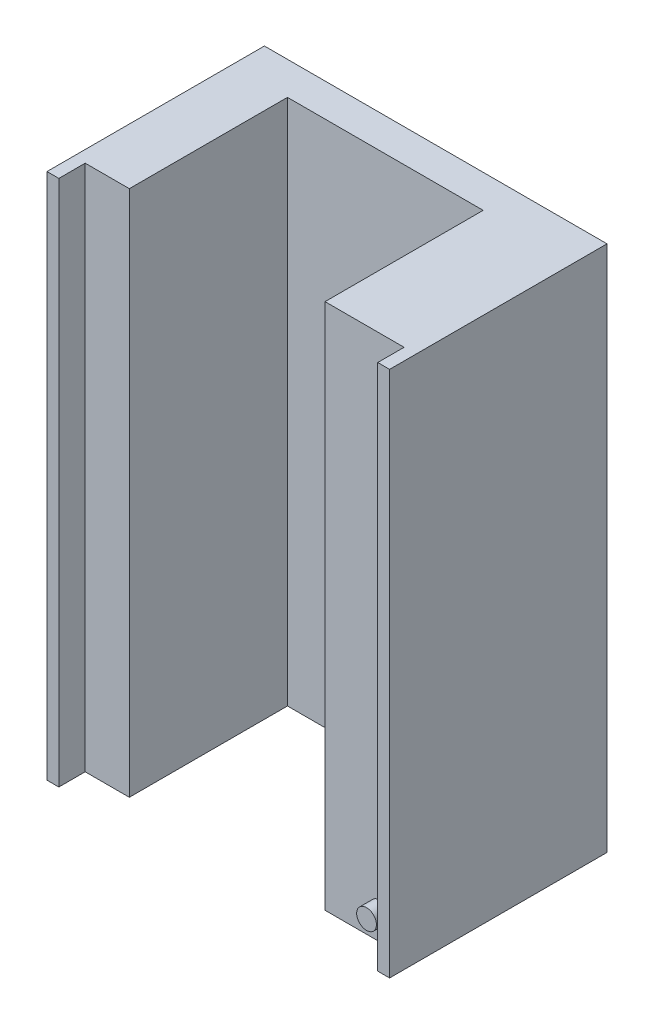
from build123d import *

# Parameters (mm, degrees)
PROFILE_EXTRUDE_DEPTH  = 40
SPROCKET_SKETCH_R      = 0.75
SPROCKET_EXTRUDE_DEPTH = 1


with BuildPart() as part:
    # Profile Sketch → Profile Extrude (new body)
    with BuildSketch(Plane(origin=(0.045617437, 0, -0.024209872), x_dir=(-1, 0, 0), z_dir=(0, 1, 0))):
        Polygon((5.945617437, -11.975790128), (5.945617437, 0.024209872), (-0.054382563, 0.024209872), (-0.054382563, 2.024209872), (-0.954382563, 2.024209872), (-0.954382563, -14.475790128), (25.045617437, -14.475790128), (25.045617437, 2.024209872), (24.145617437, 2.024209872), (24.145617437, 0.024209872), (20.795617437, 0.024209872), (20.795617437, -11.975790128), align=None)
    extrude(amount=PROFILE_EXTRUDE_DEPTH)

    # Sprocket Sketch → Sprocket Extrude (add)
    with BuildSketch(Plane.XY):
        with Locations(Location((-1.75, 2, 0), (0, 0, 180))):
            Circle(SPROCKET_SKETCH_R)
    extrude(amount=SPROCKET_EXTRUDE_DEPTH)


solid = part.part
